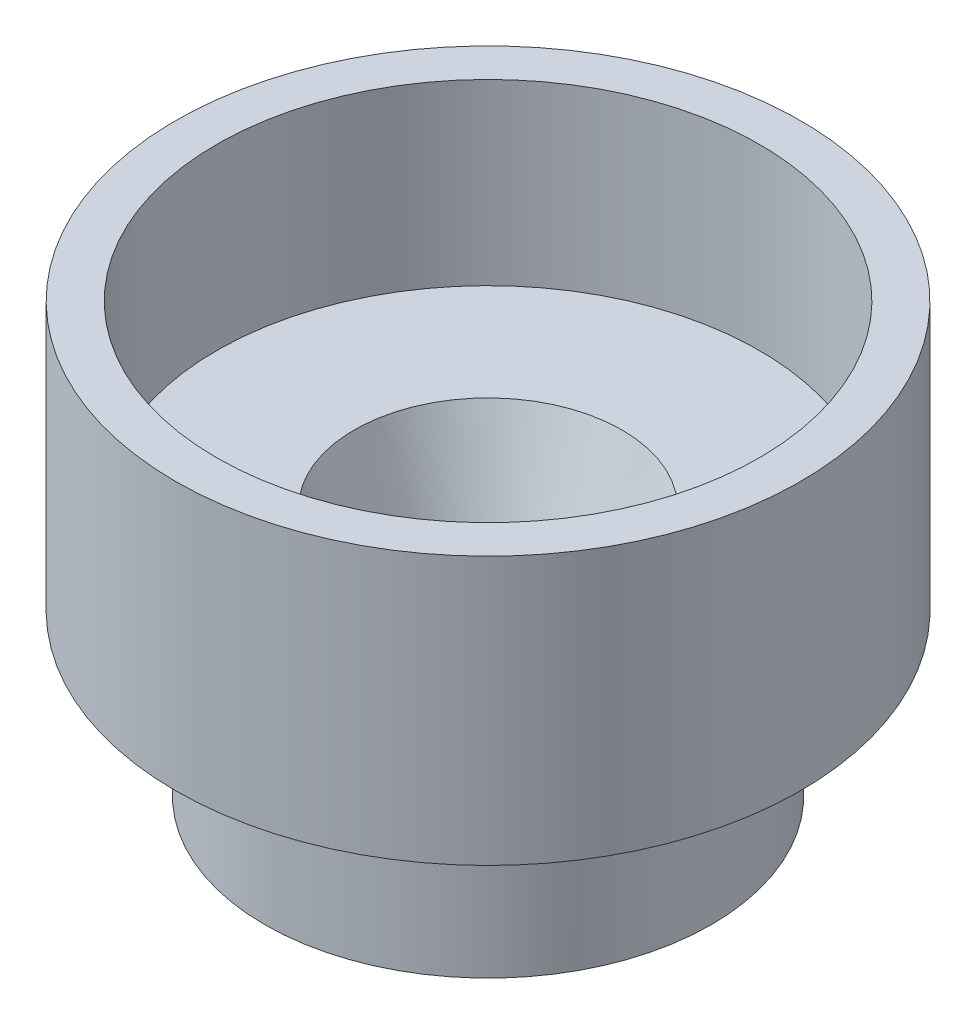
from build123d import *

# Parameters (mm, degrees)
SKETCH1_R           = 8.75
SKETCH1_R_2         = 7.6
BOSS_EXTRUDE1_DEPTH = 7.5
SKETCH1_2_R         = 7.6
BOSS_EXTRUDE2_DEPTH = 2.5
SKETCH2_R           = 6.25
SKETCH2_R_2         = 3.75
BOSS_EXTRUDE3_DEPTH = 4.5
CUT_EXTRUDE1_START  = -4.5
SKETCH3_R           = 3.75
CUT_EXTRUDE1_DEPTH  = 4.5


with BuildPart() as part:
    # Sketch1 → Boss-Extrude1 (new body)
    with BuildSketch(Plane(origin=(0, 0, 0), x_dir=(1, 0, 0), z_dir=(0, 1, 0))):
        Circle(SKETCH1_R)
        Circle(SKETCH1_R_2, mode=Mode.SUBTRACT)
    extrude(amount=BOSS_EXTRUDE1_DEPTH)

    # Sketch1<2> → Boss-Extrude2 (add)
    with BuildSketch(Plane(origin=(0, 0, 0), x_dir=(1, 0, 0), z_dir=(0, 1, 0))):
        Circle(SKETCH1_2_R)
    extrude(amount=BOSS_EXTRUDE2_DEPTH)

    # Sketch2 → Boss-Extrude3 (add)
    with BuildSketch(Plane.XZ):
        Circle(SKETCH2_R)
        Circle(SKETCH2_R_2, mode=Mode.SUBTRACT)
    extrude(amount=BOSS_EXTRUDE3_DEPTH)

    # Sketch3 → Cut-Extrude1 (cut)
    with BuildSketch(Plane.XZ.offset(CUT_EXTRUDE1_START)):
        Circle(SKETCH3_R)
    extrude(amount=CUT_EXTRUDE1_DEPTH, mode=Mode.SUBTRACT)

    # Sketch4 → Revolve1 (revolve)
    with BuildSketch(Plane.XY):
        Polygon((3.75, -1.5), (3.75, 2.5), (2.25, -1.5), align=None)
    revolve(axis=Axis((0, 6.48863082, 0), (0, -1, 0)))


solid = part.part
